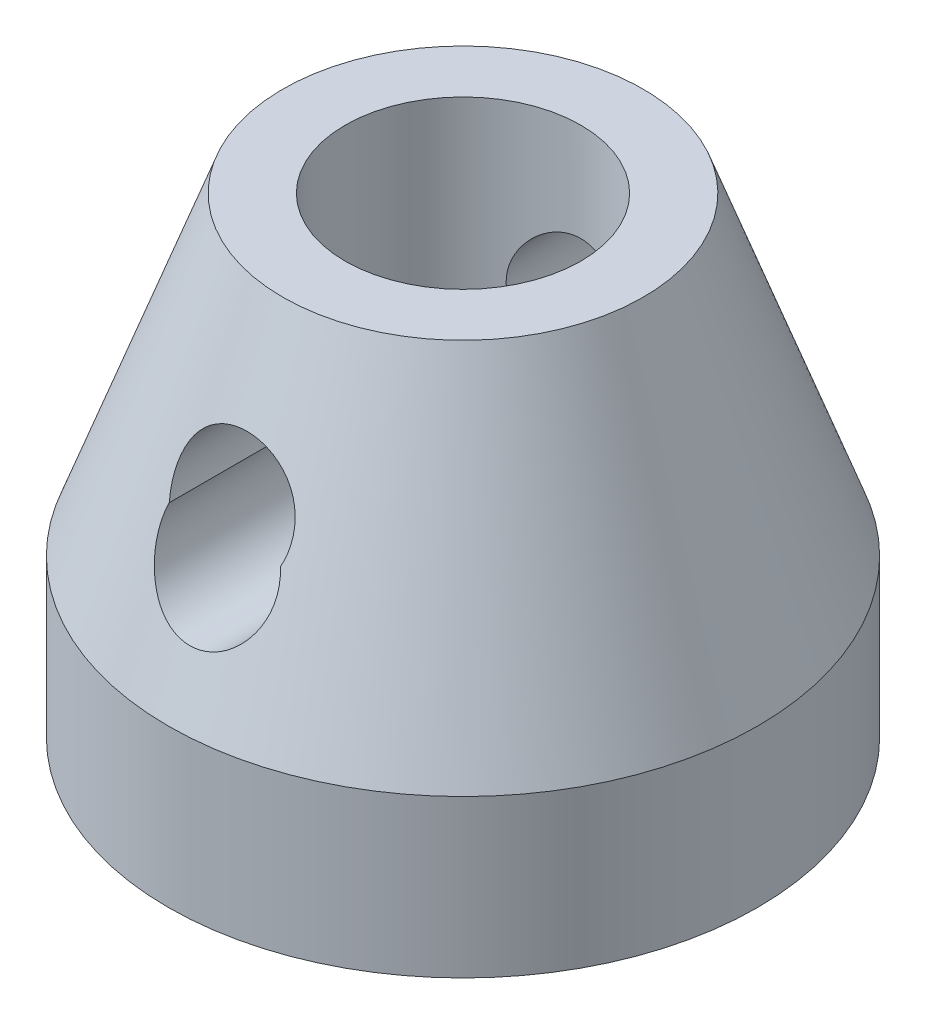
from build123d import *

# Parameters (mm, degrees)
SKETCH1_R           = 7.5
BOSS_EXTRUDE1_DEPTH = 4
SKETCH4_R           = 7.5
BOSS_EXTRUDE4_DEPTH = 8
BOSS_EXTRUDE4_TAPER = 20
SKETCH5_R           = 1.5
CUT_EXTRUDE2_DEPTH  = 17.015617547
SKETCH6_R           = 3
CUT_EXTRUDE3_DEPTH  = 9
SKETCH7_R           = 1.5
CUT_EXTRUDE4_DEPTH  = 23.505555034
SKETCH8_R           = 1.5
CUT_EXTRUDE5_DEPTH  = 23.505555034


with BuildPart() as part:
    # Sketch1 → Boss-Extrude1 (new body)
    with BuildSketch(Plane(origin=(0, 0, 0), x_dir=(1, 0, 0), z_dir=(0, 1, 0))):
        with Locations(Location((0, 0, 0), (0, 0, 270))):
            Circle(SKETCH1_R)
    extrude(amount=BOSS_EXTRUDE1_DEPTH)

    # Sketch4 → Boss-Extrude4 (add)
    with BuildSketch(Plane(origin=(0, 4, 0), x_dir=(1, 0, 0), z_dir=(0, 1, 0))):
        with Locations(Location((0, 0, 0), (0, 0, 270))):
            Circle(SKETCH4_R)
    extrude(amount=BOSS_EXTRUDE4_DEPTH, taper=BOSS_EXTRUDE4_TAPER)

    # Sketch5 → Cut-Extrude2 (cut, through all)
    with BuildSketch(Plane(origin=(0, 0, 0), x_dir=(-1, 0, 0), z_dir=(0, -1, 0))):
        with Locations(Location((0, 0, 0), (0, 0, 90))):
            Circle(SKETCH5_R)
    extrude(amount=-CUT_EXTRUDE2_DEPTH, mode=Mode.SUBTRACT)

    # Sketch6 → Cut-Extrude3 (cut)
    with BuildSketch(Plane(origin=(0, 12, 0), x_dir=(1, 0, 0), z_dir=(0, 1, 0))):
        with Locations(Location((0, 0, 0), (0, 0, 270))):
            Circle(SKETCH6_R)
    extrude(amount=-CUT_EXTRUDE3_DEPTH, mode=Mode.SUBTRACT)

    # Sketch7 → Cut-Extrude4 (cut, through all)
    with BuildSketch(Plane.XY.offset(10)):
        with Locations((0, 8)):
            Circle(SKETCH7_R)
    extrude(amount=-CUT_EXTRUDE4_DEPTH, mode=Mode.SUBTRACT)

    # Sketch8 → Cut-Extrude5 (cut, through all)
    with BuildSketch(Plane.XY.offset(10)):
        with Locations((0, 7)):
            Circle(SKETCH8_R)
    extrude(amount=-CUT_EXTRUDE5_DEPTH, mode=Mode.SUBTRACT)


solid = part.part
